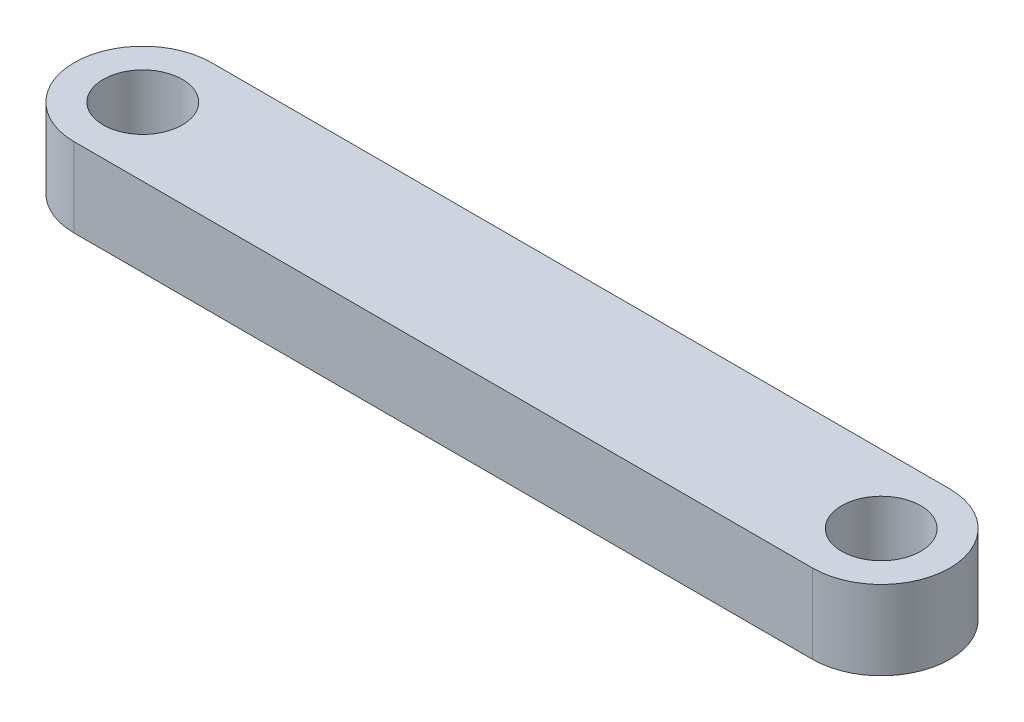
from build123d import *

# Parameters (mm, degrees)
SKETCH1_R           = 7.5
BOSS_EXTRUDE1_DEPTH = 15


with BuildPart() as part:
    # Sketch1 → Boss-Extrude1 (new body)
    with BuildSketch(Plane.XZ):
        with BuildLine():
            Line((-70, 13), (70, 13))
            ThreePointArc((70, 13), (83, 0), (70, -13))
            Line((70, -13), (-70, -13))
            ThreePointArc((-70, -13), (-83, 0), (-70, 13))
        make_face()
        with Locations(Location((-70, 0, 0), (0, 0, 90))):
            Circle(SKETCH1_R, mode=Mode.SUBTRACT)
        with Locations(Location((70, 0, 0), (0, 0, 90))):
            Circle(SKETCH1_R, mode=Mode.SUBTRACT)
    extrude(amount=-BOSS_EXTRUDE1_DEPTH)


solid = part.part
